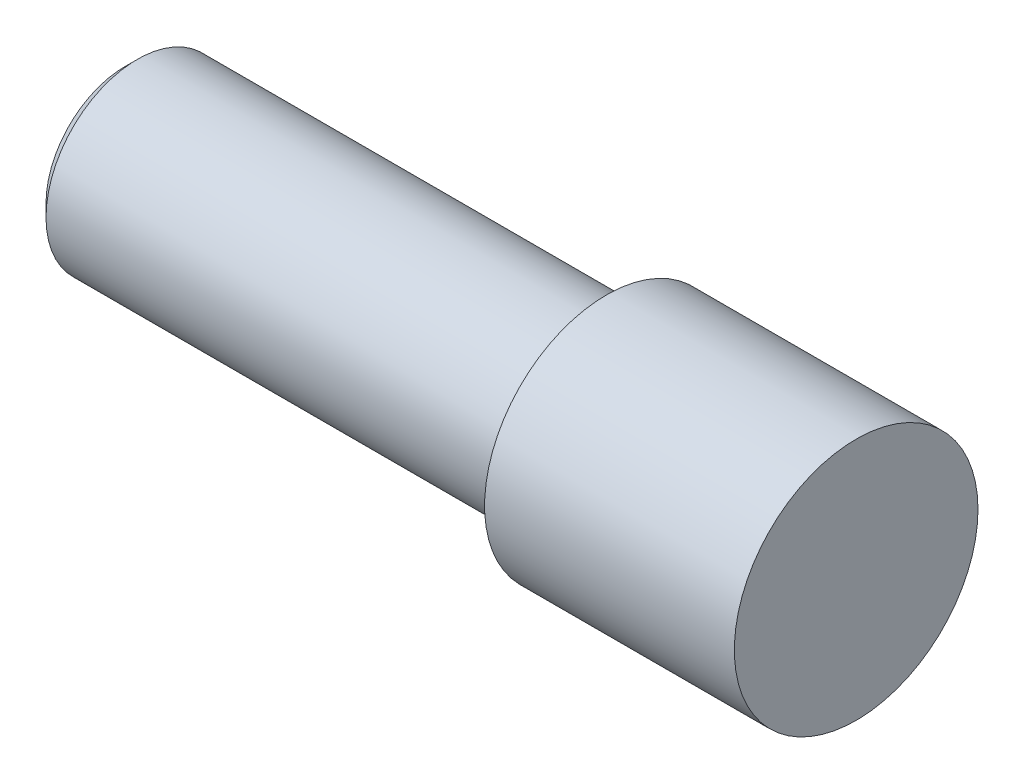
from build123d import *

# Parameters (mm, degrees)
SKETCH1_R           = 2
BOSS_EXTRUDE1_DEPTH = 4.1
SKETCH2_R           = 1.5
BOSS_EXTRUDE2_DEPTH = 7.9
CHAMFER1_SIZE       = 0.2


with BuildPart() as part:
    # Sketch1 → Boss-Extrude1 (new body)
    with BuildSketch(Plane(origin=(0, 0, 0), x_dir=(0, 0, -1), z_dir=(1, 0, 0))):
        Circle(SKETCH1_R)
    extrude(amount=BOSS_EXTRUDE1_DEPTH)

    # Sketch2 → Boss-Extrude2 (add)
    with BuildSketch(Plane.ZY):
        with Locations(Location((0, 0, 0), (0, 0, 180))):
            Circle(SKETCH2_R)
    extrude(amount=BOSS_EXTRUDE2_DEPTH)

    # Chamfer1
    chamfer1_edges = [part.edges().sort_by_distance(p)[0] for p in [
        (-7.9, 0, 1.5),
    ]]
    chamfer(chamfer1_edges, length=CHAMFER1_SIZE)


solid = part.part
